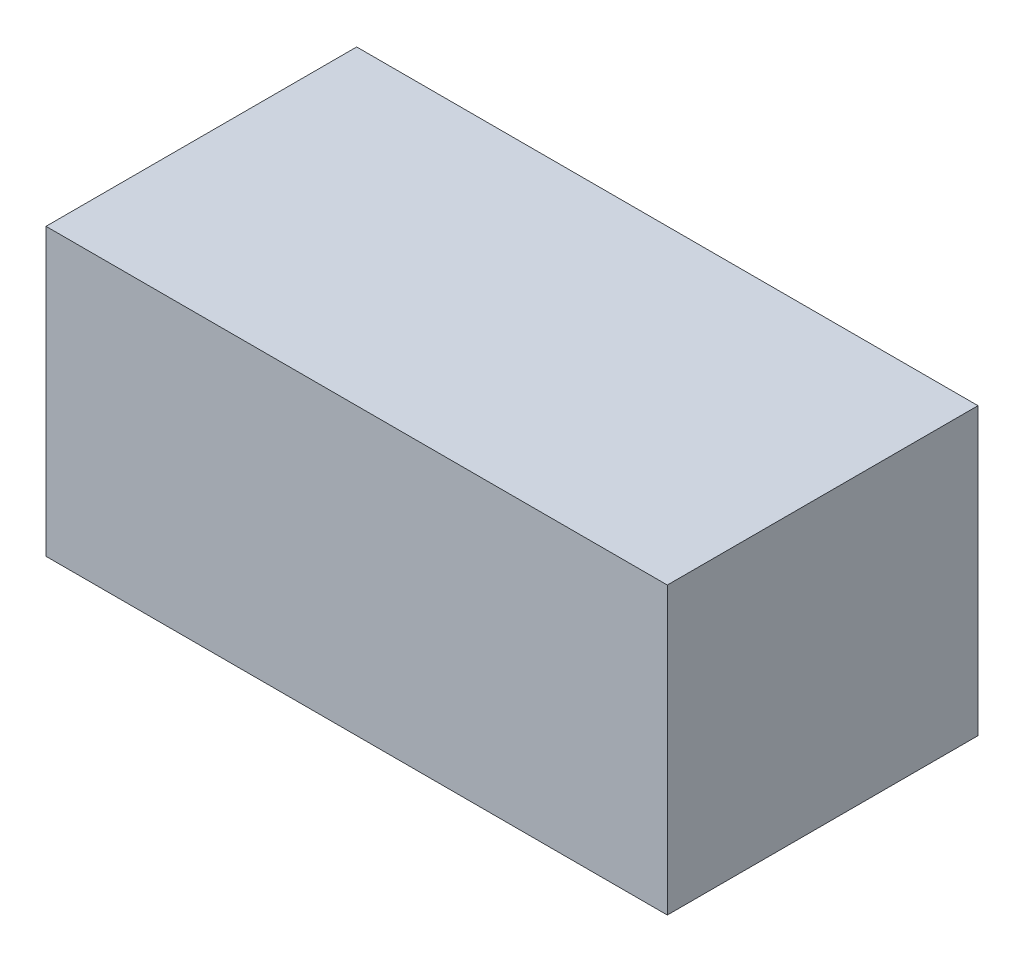
from build123d import *

# Parameters (mm, degrees)
ESBO_O1_W                = 50
ESBO_O1_H                = 25
RESSALTO_EXTRUS_O1_DEPTH = 23


with BuildPart() as part:
    # Esboço1 → Ressalto-extrusão1 (new body)
    with BuildSketch(Plane(origin=(0, 0, 0), x_dir=(1, 0, 0), z_dir=(0, 1, 0))):
        Rectangle(ESBO_O1_W, ESBO_O1_H)
    extrude(amount=RESSALTO_EXTRUS_O1_DEPTH)


solid = part.part
